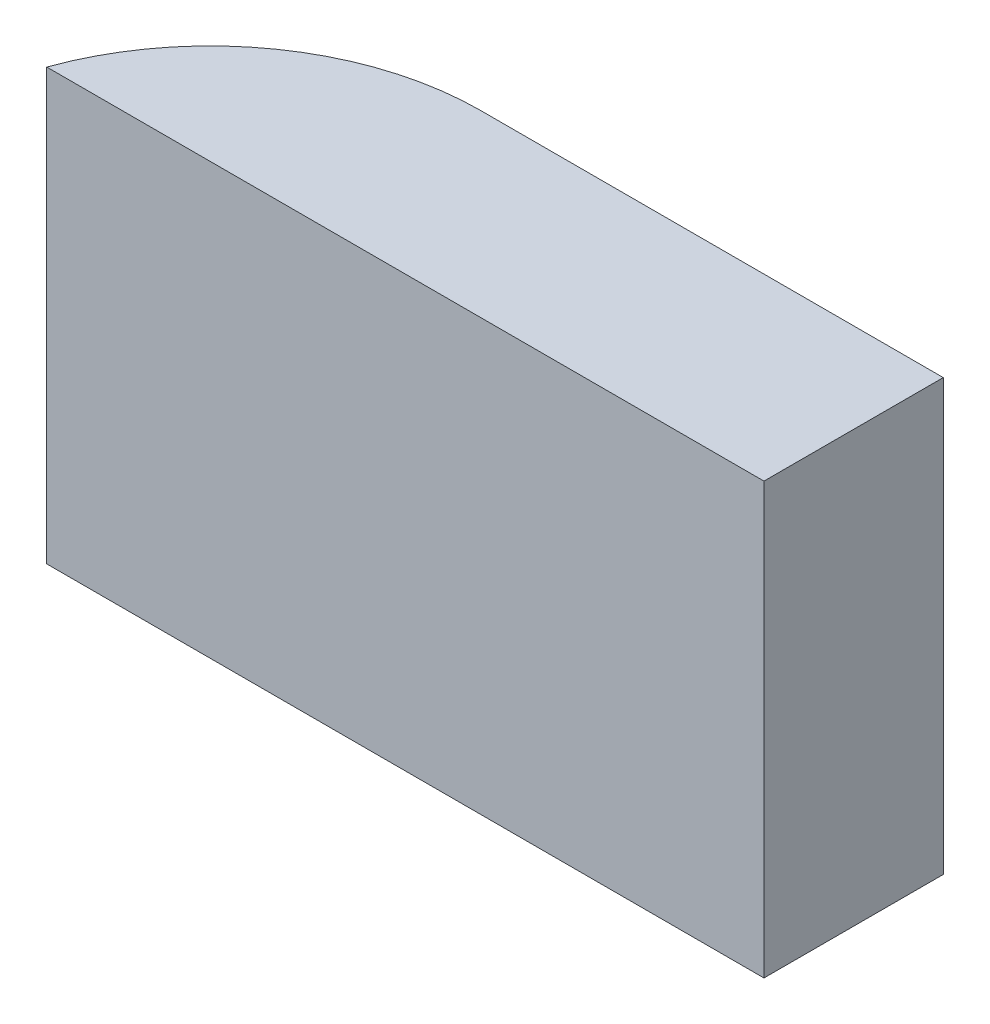
from build123d import *

# Parameters (mm, degrees)
BOSS_EXTRUDE1_DEPTH = 76.2


with BuildPart() as part:
    # Sketch1 → Boss-Extrude1 (new body)
    with BuildSketch(Plane(origin=(0, 0, 0), x_dir=(1, 0, 0), z_dir=(0, 1, 0))):
        with BuildLine():
            Line((0, 0), (0, -31.75))
            Line((0, -31.75), (-127, -31.75))
            ThreePointArc((-127, -31.75), (-109.458440984, -8.732654957), (-81.867768595, 0))
            Line((-81.867768595, 0), (0, 0))
        make_face()
    extrude(amount=BOSS_EXTRUDE1_DEPTH)


solid = part.part
